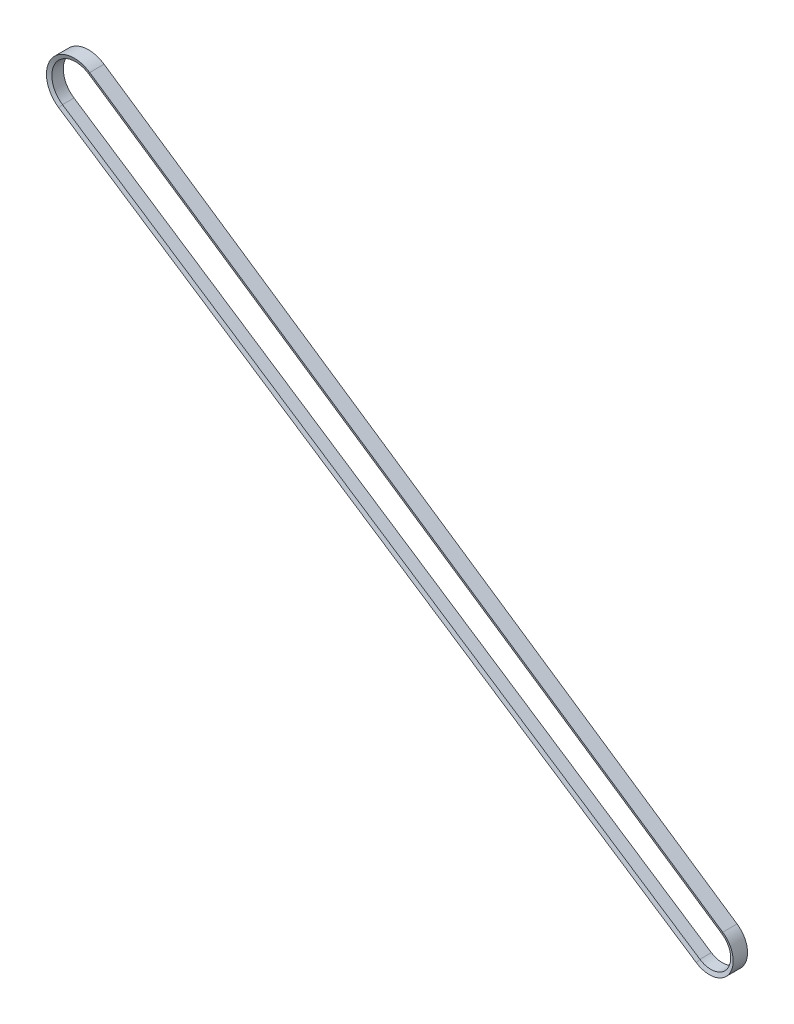
from build123d import *


with BuildPart() as part:
    # 扫描2: sweep along a path in 草图2
    with BuildLine(Plane.XY) as sweep_2_path:
        Line((166.672309704, -117.827778519), (-3.503572701, -5.298380573))
        ThreePointArc((-3.503572701, -5.298380573), (-5.280244447, 3.530846491), (3.558026402, 5.261967929))
        Line((3.558026402, 5.261967929), (172.564390373, -109.016399628))
        ThreePointArc((172.564390373, -109.016399628), (174.001380423, -116.352977522), (166.672309704, -117.827778519))
    # 草图4 → 扫描2 (sweep)
    with BuildSketch(Plane(origin=(172.564390373, -109.016399628, 0), x_dir=(0, 0, -1), z_dir=(0.8283959233301038, -0.5601430122835281, 0))):
        Polygon((-1.535, 0), (1.535, 0), (1.917895379, 1.051996408), (-1.917895379, 1.051996408), align=None)
    sweep(path=sweep_2_path.line)


solid = part.part
